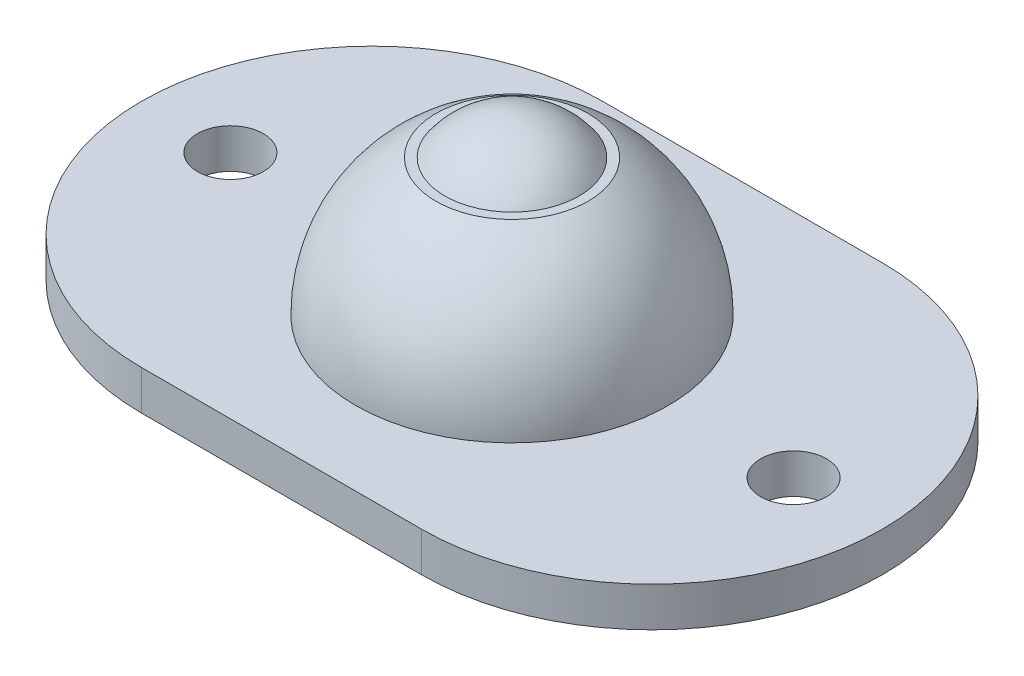
from build123d import *

# Parameters (mm, degrees)
SKETCH1_R           = 2
BOSS_EXTRUDE1_DEPTH = 2.4


with BuildPart() as part:
    # Sketch1 → Boss-Extrude1 (new body)
    with BuildSketch(Plane(origin=(0, 0, 0), x_dir=(1, 0, 0), z_dir=(0, 1, 0))):
        with BuildLine():
            Line((-8.5, 14), (8.5, 14))
            ThreePointArc((8.5, 14), (22.5, 0), (8.5, -14))
            Line((8.5, -14), (-8.5, -14))
            ThreePointArc((-8.5, -14), (-22.5, 0), (-8.5, 14))
        make_face()
        with Locations(Location((17.1, 0, 0), (0, 0, 270))):
            Circle(SKETCH1_R, mode=Mode.SUBTRACT)
        with Locations(Location((-17.1, 0, 0), (0, 0, 270))):
            Circle(SKETCH1_R, mode=Mode.SUBTRACT)
    extrude(amount=BOSS_EXTRUDE1_DEPTH)

    # Sketch2 → Revolve1 (revolve)
    with BuildSketch(Plane(origin=(0, 0, 0), x_dir=(0, 0, -1), z_dir=(1, 0, 0)), mode=Mode.PRIVATE) as revolve1_sk:
        with BuildLine():
            Line((-4.621688003, 10.7), (0, 10.7))
            Line((0, 10.7), (0, 2.4))
            Line((0, 2.4), (-9.5, 2.4))
            ThreePointArc((-9.5, 2.4), (-8.190117094, 7.213728491), (-4.621688003, 10.7))
        make_face()
    revolve(revolve1_sk.sketch.rotate(Axis((0, 2.4, 0), (0, 1, 0)), 180), axis=Axis((0, 2.4, 0), (0, 1, 0)))

    # Sketch3 → Revolve2 (revolve)
    with BuildSketch(Plane(origin=(0, 0, 0), x_dir=(0, 0, -1), z_dir=(1, 0, 0))):
        with BuildLine():
            Line((0, 12.8), (0, 2.8))
            ThreePointArc((0, 2.8), (-5, 7.8), (0, 12.8))
        make_face()
    revolve(axis=Axis((0, 12.8, 0), (0, -1, 0)))


solid = part.part
